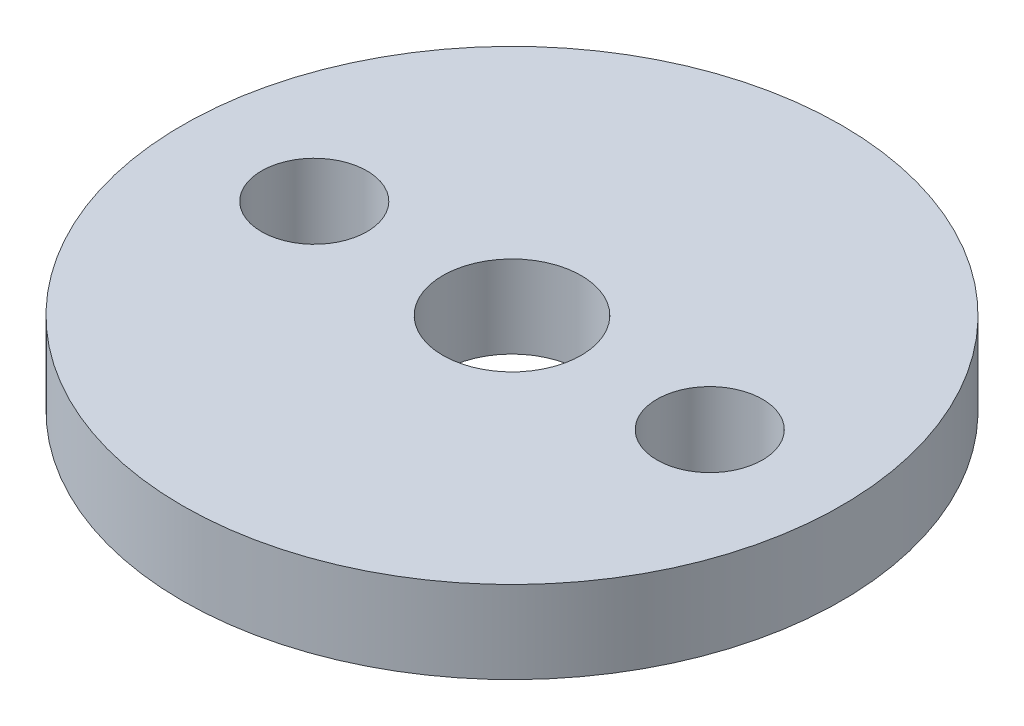
from build123d import *

# Parameters (mm, degrees)
SKETCH1_R               = 10
BOSS_EXTRUDE1_DEPTH     = 2.5
CUT_EXTRUDE1_DEPTH      = 15.361406616
CUT_EXTRUDE1_DEPTH_BACK = 15.361406616
SKETCH2_R               = 2.1
SKETCH2_R_2             = 1.6


with BuildPart() as part:
    # Sketch1 → Boss-Extrude1 (new body)
    with BuildSketch(Plane(origin=(0, 0, 0), x_dir=(1, 0, 0), z_dir=(0, 1, 0))):
        with Locations(Location((0, 0, 0), (0, 0, 270))):
            Circle(SKETCH1_R)
    extrude(amount=BOSS_EXTRUDE1_DEPTH)

    # Sketch2 → Cut-Extrude1 (cut, two sides: drawn at the far end of the back side and taken through both)
    with BuildSketch(Plane(origin=(0, 0, 0), x_dir=(1, 0, 0), z_dir=(0, 1, 0)).offset(-CUT_EXTRUDE1_DEPTH_BACK)):
        with Locations(Location((0, 0, 0), (0, 0, 270))):
            Circle(SKETCH2_R)
        with Locations(Location((6, 0, 0), (0, 0, 270))):
            Circle(SKETCH2_R_2)
        with Locations(Location((-6, 0, 0), (0, 0, 270))):
            Circle(SKETCH2_R_2)
    extrude(amount=CUT_EXTRUDE1_DEPTH + CUT_EXTRUDE1_DEPTH_BACK, mode=Mode.SUBTRACT)


solid = part.part
